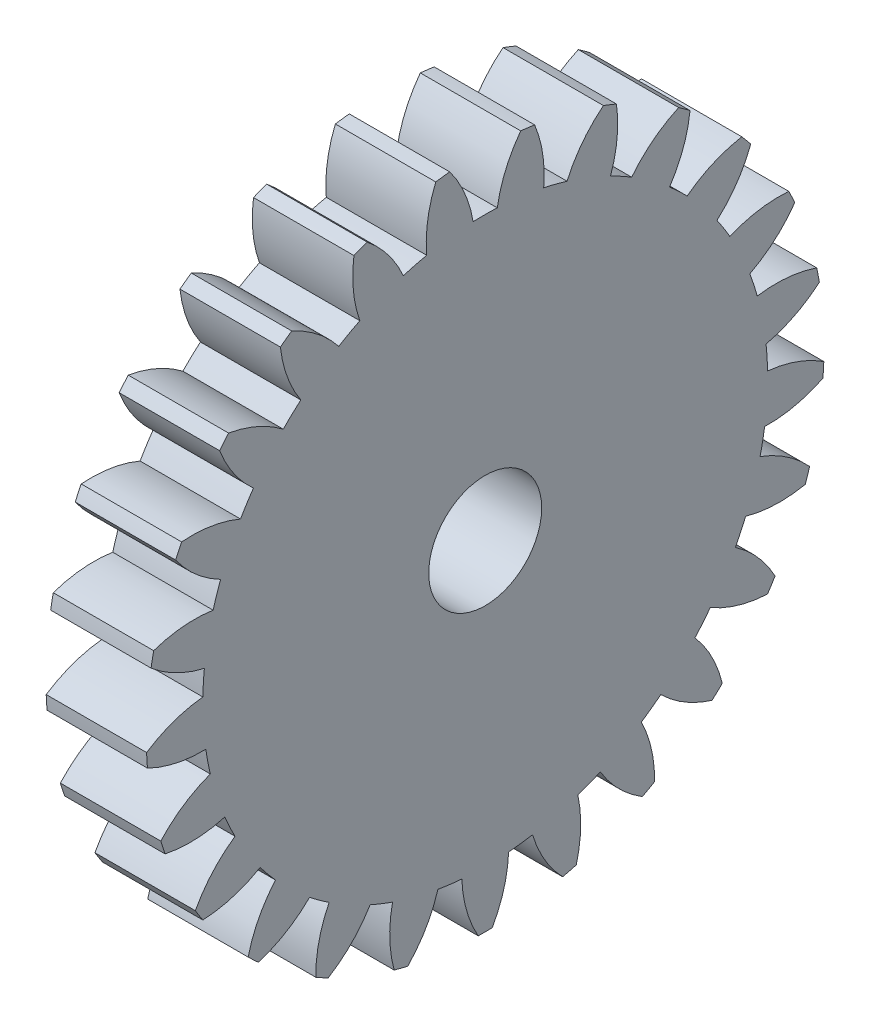
from build123d import *

# Parameters (mm, degrees)
BASPROSKE_W        = 4
BASPROSKE_H        = 13.5
TOOTHCUT_DEPTH     = 20.506409203
TEETHCUTS_COUNT    = 25
TEETHCUTS_ANGLE    = 345.6
BORSKE_R           = 0.4
BORE_DEPTH         = 50.0000508
SKETCH1_R          = 2.25
CUT_EXTRUDE1_DEPTH = 20.498122865


with BuildPart() as part:
    # BasProSke → Base-Revolve (revolve)
    with BuildSketch(Plane(origin=(0, 0, 0), x_dir=(1, 0, 0), z_dir=(0, 1, 0)), mode=Mode.PRIVATE) as base_revolve_sk:
        with Locations((2, 6.75)):
            Rectangle(BASPROSKE_W, BASPROSKE_H)
    revolve(base_revolve_sk.sketch.rotate(Axis((-10, 0, 0), (1, 0, 0)), 180), axis=Axis((-10, 0, 0), (1, 0, 0)))

    # TooCutSke → ToothCut (cut, through all)
    with BuildSketch(Plane(origin=(0, 0, 0), x_dir=(0, 0, -1), z_dir=(1, 0, 0))):
        with BuildLine():
            ThreePointArc((0.480087995, 11.238750665), (0, 11.249), (-0.480087995, 11.238750665))
            ThreePointArc((-0.480087995, 11.238750665), (-0.821124963, 12.40220054), (-1.432168974, 13.449361962))
            ThreePointArc((-1.432168974, 13.449361962), (0, 13.5254), (1.432168974, 13.449361962))
            ThreePointArc((1.432168974, 13.449361962), (0.821124963, 12.40220054), (0.480087995, 11.238750665))
        make_face()
    toothcut = extrude(amount=TOOTHCUT_DEPTH, mode=Mode.SUBTRACT)

    # TeethCuts: ToothCut ×25 about axis
    teethcuts_axis = Axis((-10, 0, 0), (1, 0, 0))
    for i in range(1, TEETHCUTS_COUNT):
        add(toothcut.rotate(teethcuts_axis, i * TEETHCUTS_ANGLE / (TEETHCUTS_COUNT - 1)), mode=Mode.SUBTRACT)

    # BorSke → Bore (cut, symmetric)
    with BuildSketch(Plane(origin=(0, 0, 0), x_dir=(0, 0, -1), z_dir=(1, 0, 0))):
        with Locations(Location((0, 0, 0), (0, 0, 180))):
            Circle(BORSKE_R)
    extrude(amount=BORE_DEPTH, both=True, mode=Mode.SUBTRACT)

    # Sketch1 → Cut-Extrude1 (cut, through all)
    with BuildSketch(Plane(origin=(4, 0, 0), x_dir=(0, 0, -1), z_dir=(1, 0, 0))):
        Circle(SKETCH1_R)
    extrude(amount=-CUT_EXTRUDE1_DEPTH, mode=Mode.SUBTRACT)


solid = part.part
